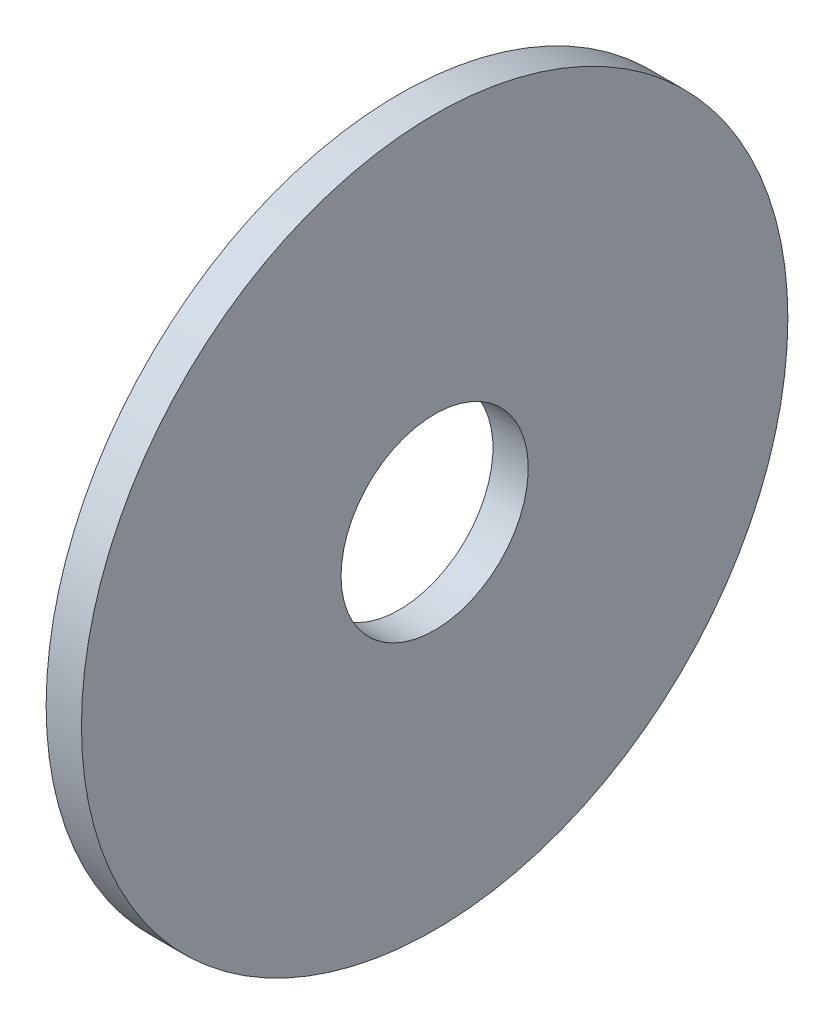
from build123d import *

# Parameters (mm, degrees)
ESQUISSE1_W = 1
ESQUISSE1_H = 7.35


with BuildPart() as part:
    # Esquisse1 → Base-Révolution (revolve)
    with BuildSketch(Plane(origin=(0, 0, 0), x_dir=(1, 0, 0), z_dir=(0, 1, 0))):
        with Locations((0.5, 6.325)):
            Rectangle(ESQUISSE1_W, ESQUISSE1_H)
    revolve(axis=Axis((0, 0, 0), (1, 0, 0)))


solid = part.part
